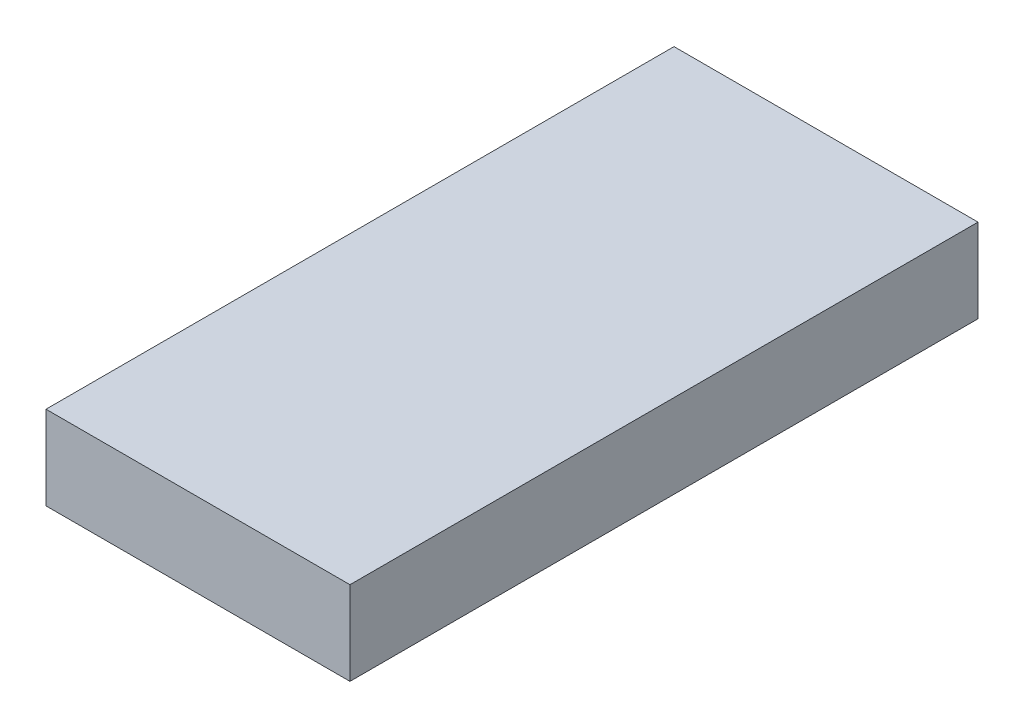
from build123d import *

# Parameters (mm, degrees)
SKETCH1_W           = 72.6
SKETCH1_H           = 150
BOSS_EXTRUDE1_DEPTH = 20


with BuildPart() as part:
    # Sketch1 → Boss-Extrude1 (new body)
    with BuildSketch(Plane(origin=(0, 0, 0), x_dir=(1, 0, 0), z_dir=(0, 1, 0))):
        with Locations((4.371348163, 51.053511122)):
            Rectangle(SKETCH1_W, SKETCH1_H)
    extrude(amount=BOSS_EXTRUDE1_DEPTH)


solid = part.part
